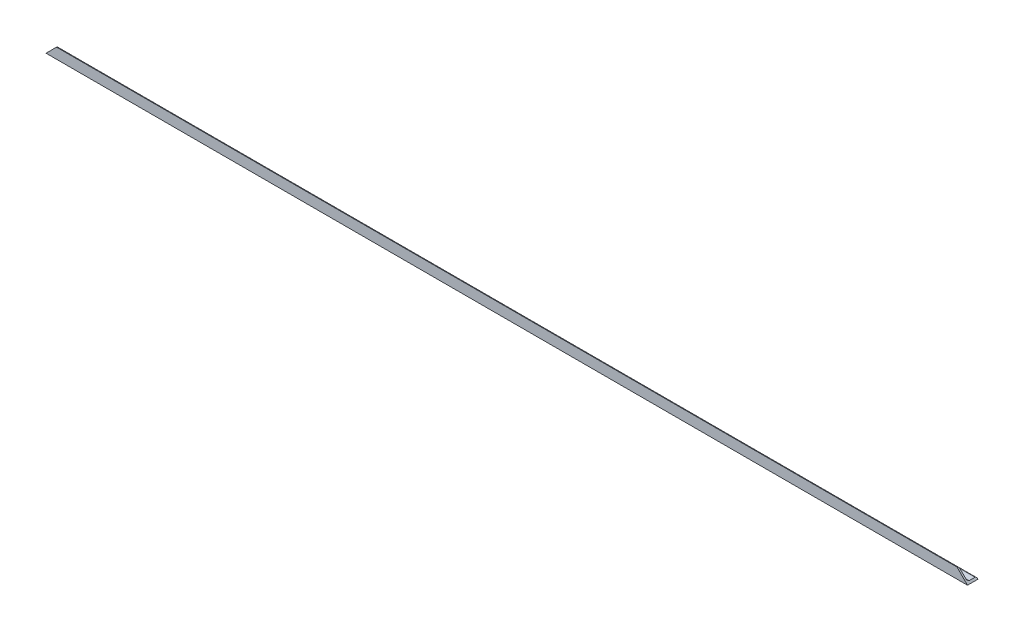
from build123d import *

# Parameters (mm, degrees)
L_ANGLE_EQUAL_20X20X3_1_DEPTH = 1754
CUT_EXTRUDE1_DEPTH            = 1755.228035348


with BuildPart() as part:
    # Sketch16 → L angle (equal) 20X20X3(1) (new body)
    with BuildSketch(Plane(origin=(0, 0, 0), x_dir=(0, 0, -1), z_dir=(1, 0, 0))):
        with BuildLine():
            Line((0, 20), (0, 0))
            Line((0, 0), (20, 0))
            ThreePointArc((20, 0), (19.121320344, 2.121320344), (17, 3))
            Line((17, 3), (6.5, 3))
            ThreePointArc((6.5, 3), (4.025126266, 4.025126266), (3, 6.5))
            Line((3, 6.5), (3, 17))
            ThreePointArc((3, 17), (2.121320344, 19.121320344), (0, 20))
        make_face()
    extrude(amount=L_ANGLE_EQUAL_20X20X3_1_DEPTH)

    # Sketch14 → Cut-Extrude1 (cut, through all)
    with BuildSketch(Plane.XY):
        Polygon((1754, 0), (1754, 20), (1734, 20), align=None)
        Polygon((0, 20), (0, 0), (20, 20), align=None)
    extrude(amount=-CUT_EXTRUDE1_DEPTH, mode=Mode.SUBTRACT)


solid = part.part
